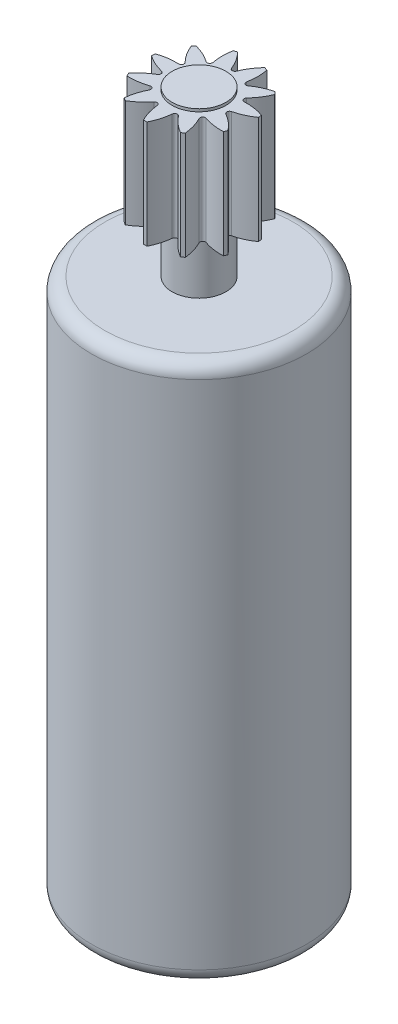
from build123d import *

# Parameters (mm, degrees)
FILLET1_R          = 0.5
CUT_EXTRUDE1_REACH = 28.608
CIRPATTERN1_COUNT  = 11


with BuildPart() as part:
    # Sketch1 → Revolve1 (revolve)
    with BuildSketch(Plane.XY, mode=Mode.PRIVATE) as revolve1_sk:
        Polygon((0, 0), (0, 26.1), (1, 26.1), (1, 26), (2, 26), (2, 22), (1, 22), (1, 20), (4, 20), (4, 0), align=None)
    revolve(revolve1_sk.sketch.rotate(Axis((0, 0, 0), (0, 1, 0)), 90), axis=Axis((0, 0, 0), (0, 1, 0)))

    # Fillet1
    fillet1_edges = [part.edges().sort_by_distance(p)[0] for p in [
        (0, 20, 4),
        (0, 0, 4),
    ]]
    fillet(fillet1_edges, radius=FILLET1_R)

    # Sketch2 → Cut-Extrude1 (cut, up to next)
    with BuildSketch(Plane(origin=(0, 26, 0), x_dir=(1, 0, 0), z_dir=(0, 1, 0)), mode=Mode.PRIVATE) as cut_extrude1_sk1:
        with BuildLine():
            ThreePointArc((0.5, 1.936491673), (0, 2), (-0.5, 1.936491673))
            ThreePointArc((-0.5, 1.936491673), (-0.266119458, 1.637619869), (-0.092905413, 1.299949383))
            ThreePointArc((-0.092905413, 1.299949383), (0, 1.236943764), (0.092905413, 1.299949383))
            ThreePointArc((0.092905413, 1.299949383), (0.266119458, 1.637619869), (0.5, 1.936491673))
        make_face()
    cut_extrude1_tool1 = extrude(cut_extrude1_sk1.sketch, amount=-CUT_EXTRUDE1_REACH, mode=Mode.PRIVATE) & part.part
    cut_extrude1 = cut_extrude1_tool1.solids().sort_by_distance((0, 26, -1.717418))[0]
    add(cut_extrude1, mode=Mode.SUBTRACT)

    # CirPattern1: Cut-Extrude1 ×11 about axis
    cirpattern1_axis = Axis((0, 0, 0), (0, 1, 0))
    for i in range(1, CIRPATTERN1_COUNT):
        add(cut_extrude1.rotate(cirpattern1_axis, i * 360 / CIRPATTERN1_COUNT), mode=Mode.SUBTRACT)


solid = part.part
